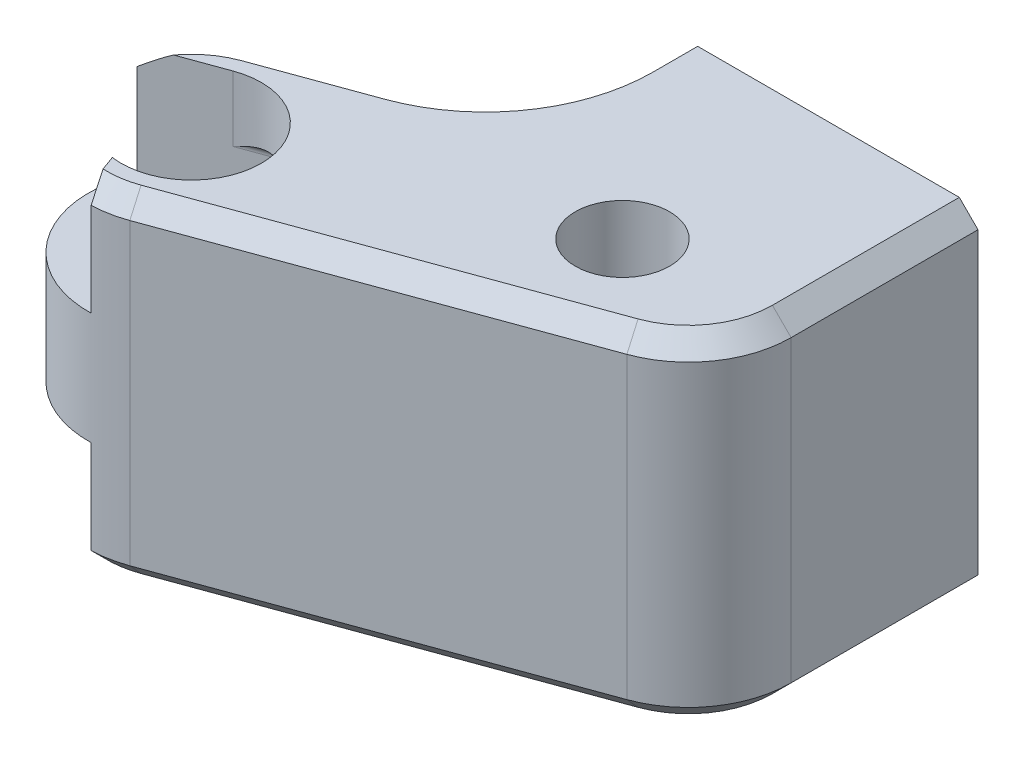
from build123d import *

# Parameters (mm, degrees)
SKETCH_1_R             = 2.51
SKETCH_1_R_2           = 2.525
EXTRUDE_1_DEPTH        = 18
SKETCH_11_R            = 3.75
CUT_EXTRUDE_5_DEPTH    = 6
FILLET_1_R             = 8
SKETCH_12_R            = 2
CUT_EXTRUDE_6_DEPTH    = 7
CHAMFER_1_SIZE         = 1
CUT_EXTRUDE_8_DEPTH    = 6
SKETCH_18_R            = 1.015
CUT_EXTRUDE_10_DEPTH   = 4
CUT_EXTRUDE_11_DEPTH   = 16
HOLE_WIZARD_M5_1_D     = 4.2
HOLE_WIZARD_M5_1_DEPTH = 7


with BuildPart() as part:
    # 草图1 → 凸台-拉伸1 (new body)
    with BuildSketch(Plane(origin=(0, 0, 0), x_dir=(1, 0, 0), z_dir=(0, 1, 0))):
        with BuildLine():
            Line((-21.381110788, -1.929110154), (-10.5, 2.031290289))
            Line((-10.5, 2.031290289), (-10.5, 10))
            Line((-10.5, 10), (5.5, 10))
            Line((5.5, 10), (5.5, 0))
            ThreePointArc((5.5, 0), (4.505336244, -3.1546704), (1.881110788, -5.168309414))
            Line((1.881110788, -5.168309414), (-17.618889212, -12.265728983))
            ThreePointArc((-17.618889212, -12.265728983), (-24.668309414, -8.978530356), (-21.381110788, -1.929110154))
        make_face()
        with Locations(Location((-19.5, -7.097419568, 0), (0, 0, 270))):
            Circle(SKETCH_1_R, mode=Mode.SUBTRACT)
        with Locations(Location((-2.585532826, -0.941056988, 0), (0, 0, 270))):
            Circle(SKETCH_1_R_2, mode=Mode.SUBTRACT)
    extrude(amount=EXTRUDE_1_DEPTH)

    # 草图11 → 切除-拉伸5 (cut)
    with BuildSketch(Plane(origin=(0, 18, 0), x_dir=(1, 0, 0), z_dir=(0, 1, 0))):
        with Locations(Location((-19.5, -7.097419568, 0), (0, 0, 270))):
            Circle(SKETCH_11_R)
    cut_extrude_5 = extrude(amount=-CUT_EXTRUDE_5_DEPTH, mode=Mode.SUBTRACT)

    # 圆角1
    fillet_1_edges = [part.edges().sort_by_distance(p)[0] for p in [
        (-10.5, 9, -2.031290289),
    ]]
    fillet(fillet_1_edges, radius=FILLET_1_R)

    # 草图12 → 切除-拉伸6 (cut)
    with BuildSketch(Plane(origin=(0, 0, -10), x_dir=(-1, 0, 0), z_dir=(0, 0, -1))):
        with Locations((4.5, 9)):
            Circle(SKETCH_12_R)
    extrude(amount=-CUT_EXTRUDE_6_DEPTH, mode=Mode.SUBTRACT)

    # 倒角1
    chamfer_1_edges = [part.edges().sort_by_distance(p)[0] for p in [
        (-24.668309414, 0, 8.978530356),
        (4.505336244, 18, 3.1546704),
        (5.5, 18, -5),
        (-10.5, 18, -8.816475297),
        (-18.572474821, 0, 0.906850263),
        (-18.572474821, 18, 0.906850263),
        (-11.946783646, 0, -3.044339104),
        (-11.946783646, 18, -3.044339104),
        (-24.668309414, 18, 8.978530356),
        (-10.5, 0, -8.816475297),
        (5.5, 0, -5),
        (-7.868889212, 18, 8.717019198),
        (4.505336244, 0, 3.1546704),
        (-7.868889212, 0, 8.717019198),
    ]]
    chamfer(chamfer_1_edges, length=CHAMFER_1_SIZE)

    # 草图15 → 切除-拉伸8 (cut)
    with BuildSketch(Plane(origin=(0, 18, 0), x_dir=(1, 0, 0), z_dir=(0, 1, 0))):
        with BuildLine():
            Line((-20.782575537, -3.57357224), (-28.300116504, -6.309733387))
            Line((-28.300116504, -6.309733387), (-24.879915071, -15.706659595))
            Line((-24.879915071, -15.706659595), (-19.006836191, -13.569033699))
            Line((-19.006836191, -13.569033699), (-20.0101096, -10.81256266))
            ThreePointArc((-20.0101096, -10.81256266), (-23.228830323, -7.495319585), (-20.782575537, -3.57357224))
        make_face()
    cut_extrude_8 = extrude(amount=-CUT_EXTRUDE_8_DEPTH, mode=Mode.SUBTRACT)

    # 草图18 → 切除-拉伸10 (cut)
    with BuildSketch(Plane(origin=(0, 0, -10), x_dir=(-1, 0, 0), z_dir=(0, 0, -1))):
        with Locations((-0.5, 13)):
            Circle(SKETCH_18_R)
        with Locations(Location((-0.5, 5, 0), (0, 0, 180))):
            Circle(SKETCH_18_R)
    extrude(amount=-CUT_EXTRUDE_10_DEPTH, mode=Mode.SUBTRACT)

    # 草图19 → 切除-拉伸11 (cut)
    with BuildSketch(Plane(origin=(-21.144462086, 0, 7.695954819), x_dir=(0.3420201433256672, 0, 0.939692620785909), z_dir=(-0.9396926207859089, 0, 0.34202014332566716))):
        with BuildLine():
            Line((-3.25, 12), (-2.85, 12))
            ThreePointArc((-2.85, 12), (-2.496446609, 12.146446609), (-2.35, 12.5))
            Line((-2.35, 12.5), (-2.35, 14.5))
            ThreePointArc((-2.35, 14.5), (-2.496446609, 14.853553391), (-2.85, 15))
            Line((-2.85, 15), (-3.25, 15))
            ThreePointArc((-3.25, 15), (-3.603553391, 14.853553391), (-3.75, 14.5))
            Line((-3.75, 14.5), (-3.75, 12.5))
            ThreePointArc((-3.75, 12.5), (-3.603553391, 12.146446609), (-3.25, 12))
        make_face()
    cut_extrude_11 = extrude(amount=-CUT_EXTRUDE_11_DEPTH, mode=Mode.SUBTRACT)

    # 镜向3: 切除-拉伸5, 切除-拉伸8, 切除-拉伸11 across plane
    add(cut_extrude_5.mirror(Plane(origin=(0, 9, 0), x_dir=(0, 0, 1), z_dir=(0, -1, 0))), mode=Mode.SUBTRACT)
    add(cut_extrude_8.mirror(Plane(origin=(0, 9, 0), x_dir=(0, 0, 1), z_dir=(0, -1, 0))), mode=Mode.SUBTRACT)
    add(cut_extrude_11.mirror(Plane(origin=(0, 9, 0), x_dir=(0, 0, 1), z_dir=(0, -1, 0))), mode=Mode.SUBTRACT)

    # M5 螺纹孔1
    with Locations(Plane(origin=(0, 0, -10), x_dir=(-1, 0, 0), z_dir=(0, 0, -1))):
        with Locations((4.5, 9)):
            Hole(HOLE_WIZARD_M5_1_D / 2, depth=HOLE_WIZARD_M5_1_DEPTH)


solid = part.part
